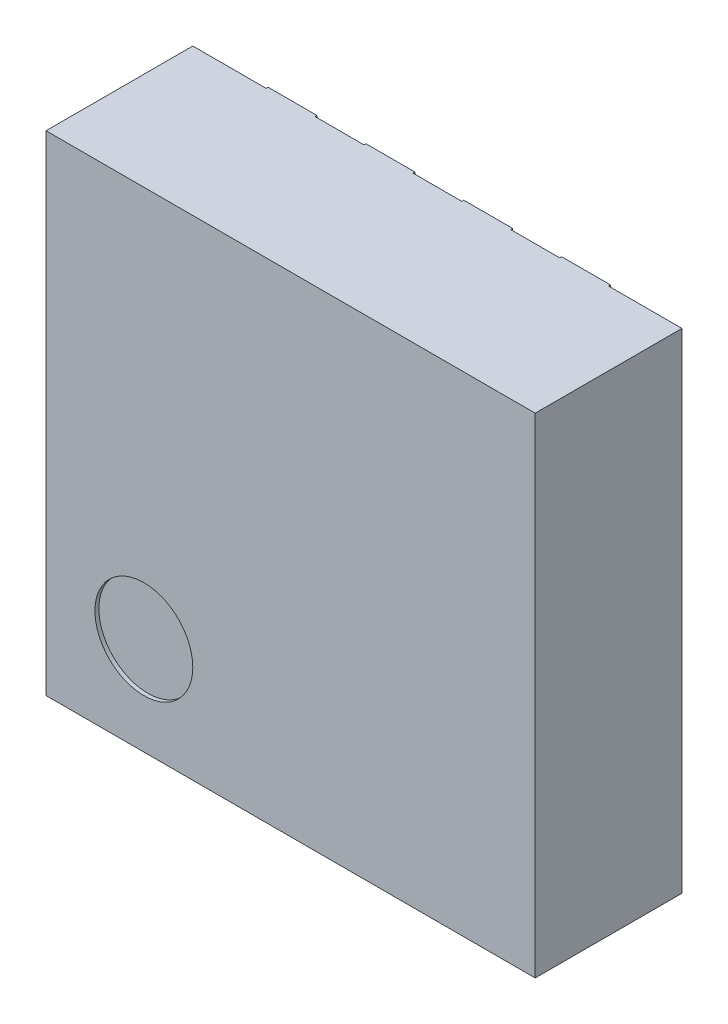
from build123d import *

# Parameters (mm, degrees)
SKETCH1_W           = 2.5
SKETCH1_H           = 2.5
BOSS_EXTRUDE1_DEPTH = 0.75
SKETCH2_R           = 0.25
CUT_EXTRUDE1_DEPTH  = 0.02
SKETCH3_W           = 0.25
SKETCH3_H           = 0.5
SKETCH3_W_2         = 1.5
SKETCH3_H_2         = 0.28
BOSS_EXTRUDE2_DEPTH = 0.01


with BuildPart() as part:
    # Sketch1 → Boss-Extrude1 (new body)
    with BuildSketch(Plane.XY):
        Rectangle(SKETCH1_W, SKETCH1_H)
    extrude(amount=BOSS_EXTRUDE1_DEPTH)

    # Sketch2 → Cut-Extrude1 (cut)
    with BuildSketch(Plane.XY.offset(0.75)):
        with Locations((-0.75, -0.75)):
            Circle(SKETCH2_R)
    extrude(amount=-CUT_EXTRUDE1_DEPTH, mode=Mode.SUBTRACT)

    # Sketch3 → Boss-Extrude2 (add)
    with BuildSketch(Plane(origin=(0, 0, 0), x_dir=(-1, 0, 0), z_dir=(0, 0, -1))):
        with Locations((0.75, -1)):
            Rectangle(SKETCH3_W, SKETCH3_H)
        with Locations((0.25, -1)):
            Rectangle(SKETCH3_W, SKETCH3_H)
        with Locations((-0.25, -1)):
            Rectangle(SKETCH3_W, SKETCH3_H)
        with Locations((-0.75, -1)):
            Rectangle(SKETCH3_W, SKETCH3_H)
        with Locations((-0.75, 1)):
            Rectangle(SKETCH3_W, SKETCH3_H)
        with Locations((-0.25, 1)):
            Rectangle(SKETCH3_W, SKETCH3_H)
        with Locations((0.25, 1)):
            Rectangle(SKETCH3_W, SKETCH3_H)
        with Locations((0.75, 1)):
            Rectangle(SKETCH3_W, SKETCH3_H)
        Rectangle(SKETCH3_W_2, SKETCH3_H_2)
    extrude(amount=BOSS_EXTRUDE2_DEPTH)


solid = part.part
